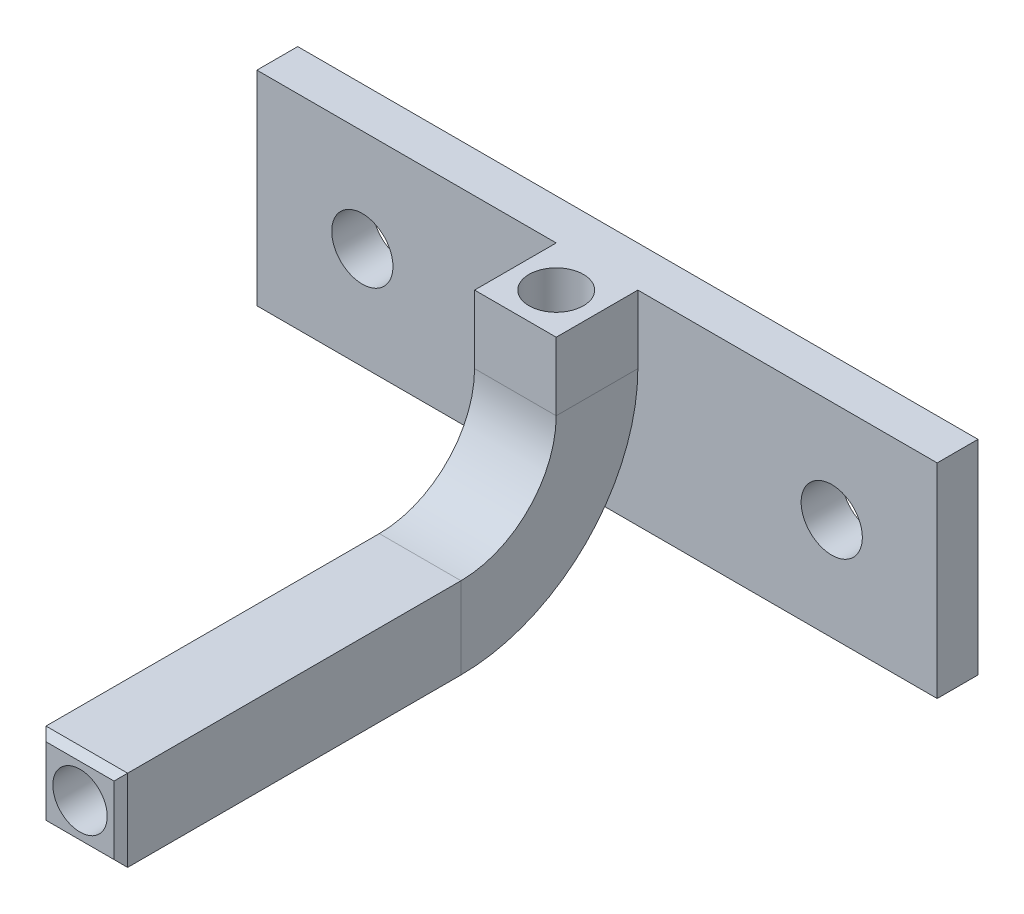
from build123d import *

# Parameters (mm, degrees)
SKETCH_1_W      = 50
SKETCH_1_H      = 15
SKETCH_1_R      = 2.25
EXTRUDE_1_DEPTH = 3
SKETCH_4_W      = 6
SKETCH_4_H      = 6
SKETCH_4_R      = 2
CHAMFER_1_SIZE  = 0.5


with BuildPart() as part:
    # Эскиз1 → Бобышка-Вытянуть1 (new body)
    with BuildSketch(Plane.XY):
        Rectangle(SKETCH_1_W, SKETCH_1_H)
        with Locations((17.25, 0)):
            Circle(SKETCH_1_R, mode=Mode.SUBTRACT)
        with Locations((-17.25, 0)):
            Circle(SKETCH_1_R, mode=Mode.SUBTRACT)
    extrude(amount=EXTRUDE_1_DEPTH)

    # По траектории1: sweep along a path in Эскиз5
    with BuildLine(Plane.ZY) as sweep_1_path:
        Line((6, 7.5), (6, 2.5))
        ThreePointArc((6, 2.5), (8.928932188, -4.571067812), (16, -7.5))
        Line((16, -7.5), (41, -7.5))
    # Эскиз4 → По траектории1 (sweep)
    with BuildSketch(Plane(origin=(0, 7.5, 0), x_dir=(1, 0, 0), z_dir=(0, 1, 0))):
        with Locations((0, -6)):
            Rectangle(SKETCH_4_W, SKETCH_4_H)
        with Locations((0, -6)):
            Circle(SKETCH_4_R, mode=Mode.SUBTRACT)
    sweep(path=sweep_1_path.line)

    # Фаска1
    chamfer_1_edges = [part.edges().sort_by_distance(p)[0] for p in [
        (3, -7.5, 41),
        (0, -10.5, 41),
        (-3, -7.5, 41),
        (0, -4.5, 41),
    ]]
    chamfer(chamfer_1_edges, length=CHAMFER_1_SIZE)


solid = part.part
